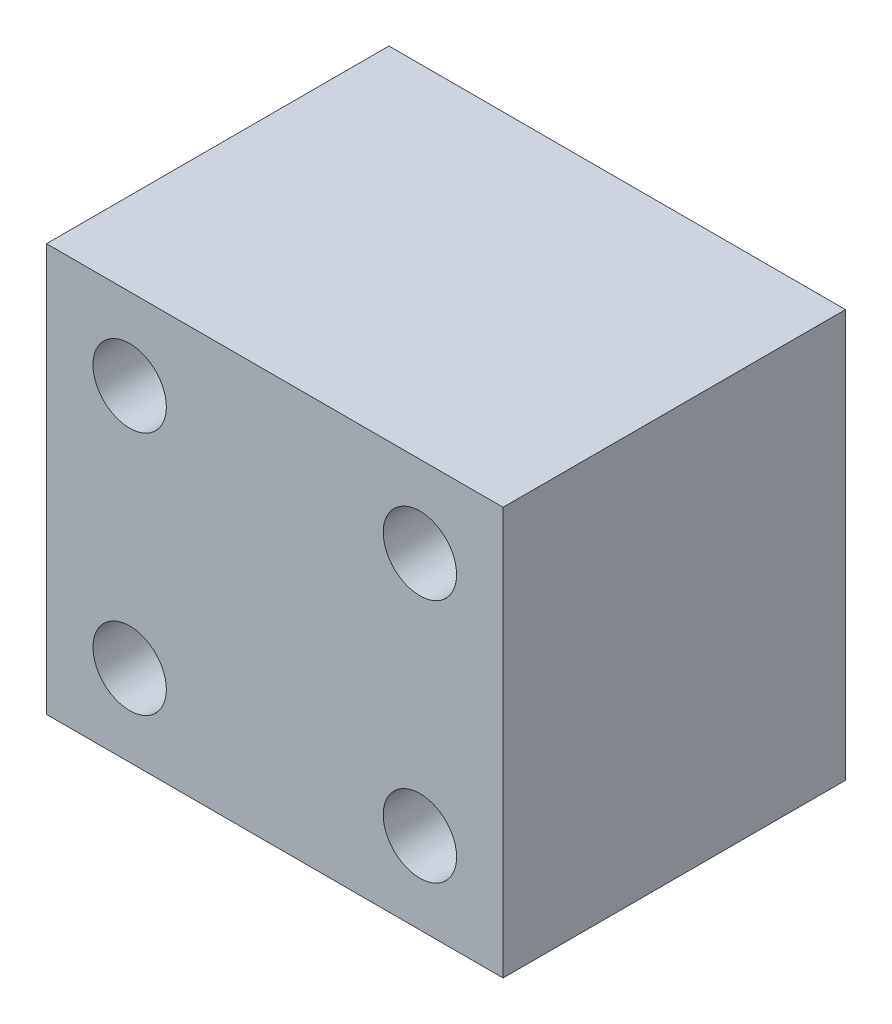
from build123d import *

# Parameters (mm, degrees)
SKETCH_1_W          = 28
SKETCH_1_H          = 25
EXTRUDE_1_DEPTH     = 21
SKETCH_2_R          = 2.25
CUT_EXTRUDE_1_DEPTH = 21


with BuildPart() as part:
    # 草图1 → 凸台-拉伸1 (new body)
    with BuildSketch(Plane.XY):
        Rectangle(SKETCH_1_W, SKETCH_1_H)
    extrude(amount=EXTRUDE_1_DEPTH)

    # 草图2 → 切除-拉伸1 (cut)
    with BuildSketch(Plane.XY.offset(21)):
        with Locations((-8.9, -7.5)):
            Circle(SKETCH_2_R)
        with Locations((8.9, -7.5)):
            Circle(SKETCH_2_R)
        with Locations((8.9, 7.5)):
            Circle(SKETCH_2_R)
        with Locations((-8.9, 7.5)):
            Circle(SKETCH_2_R)
    extrude(amount=-CUT_EXTRUDE_1_DEPTH, mode=Mode.SUBTRACT)


solid = part.part
